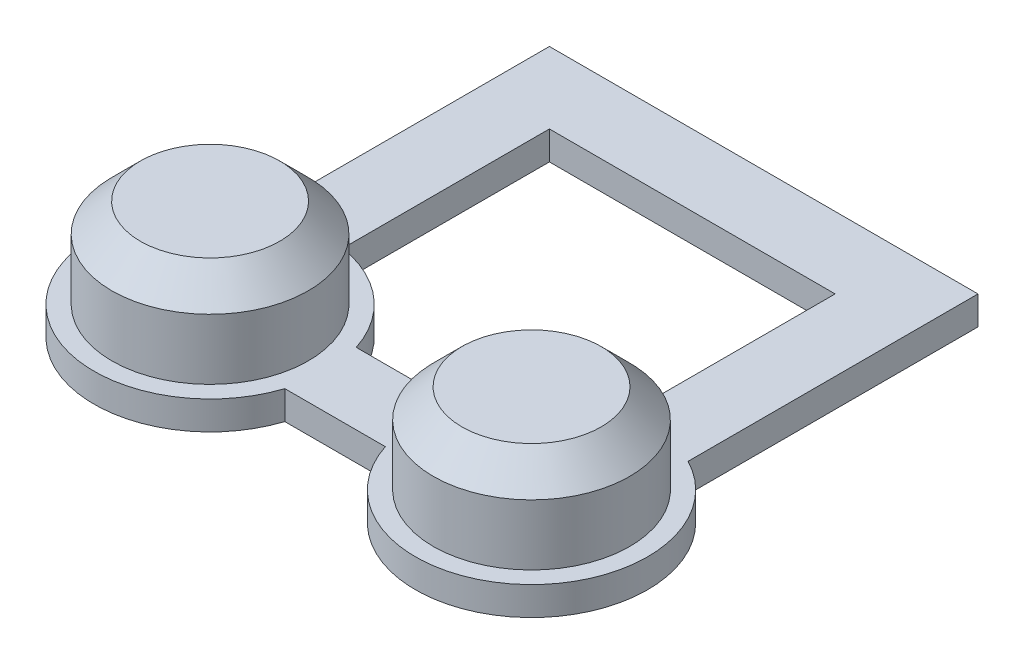
from build123d import *

# Parameters (mm, degrees)
SKETCH_1_R      = 3.25
EXTRUDE_1_DEPTH = 0.8
SKETCH_2_R      = 2.75
EXTRUDE_2_DEPTH = 2.5
CHAMFER_1_SIZE  = 0.8
SKETCH_3_R      = 1
EXTRUDE_3_DEPTH = 0.45
SKETCH_4_W      = 12
SKETCH_4_H      = 12
SKETCH_4_W_2    = 8
SKETCH_4_H_2    = 8
EXTRUDE_4_DEPTH = 0.8


with BuildPart() as part:
    # 草图1 → 凸台-拉伸1 (new body)
    with BuildSketch(Plane(origin=(0, 0, 0), x_dir=(1, 0, 0), z_dir=(0, 1, 0))):
        with Locations((-4.5, 0)):
            Circle(SKETCH_1_R)
        with BuildLine():
            Line((1.33772234, 0.75), (-1.33772234, 0.75))
            ThreePointArc((-1.33772234, 0.75), (-1.272005081, 0.377556356), (-1.25, 0))
            ThreePointArc((-1.25, 0), (-1.272005081, -0.377556356), (-1.33772234, -0.75))
            Line((-1.33772234, -0.75), (1.33772234, -0.75))
            ThreePointArc((1.33772234, -0.75), (1.25, 0), (1.33772234, 0.75))
        make_face()
        with Locations((4.5, 0)):
            Circle(SKETCH_1_R)
    extrude(amount=EXTRUDE_1_DEPTH)

    # 草图2 → 凸台-拉伸2 (add)
    with BuildSketch(Plane(origin=(0, 0.8, 0), x_dir=(1, 0, 0), z_dir=(0, 1, 0))):
        with Locations(Location((-4.5, 0, 0), (0, 0, 270))):
            Circle(SKETCH_2_R)
        with Locations(Location((4.5, 0, 0), (0, 0, 270))):
            Circle(SKETCH_2_R)
    extrude(amount=EXTRUDE_2_DEPTH)

    # 倒角1
    chamfer_1_edges = [part.edges().sort_by_distance(p)[0] for p in [
        (-4.5, 3.3, -2.75),
        (4.5, 3.3, -2.75),
    ]]
    chamfer(chamfer_1_edges, length=CHAMFER_1_SIZE)

    # 草图3 → 凸台-拉伸3 (add)
    with BuildSketch(Plane.XZ):
        with Locations(Location((-4.5, 0, 0), (0, 0, 270))):
            Circle(SKETCH_3_R)
        with Locations(Location((4.5, 0, 0), (0, 0, 90))):
            Circle(SKETCH_3_R)
    extrude(amount=EXTRUDE_3_DEPTH)

    # 草图4 → 凸台-拉伸4 (add)
    with BuildSketch(Plane.XZ):
        with Locations((0, -5)):
            Rectangle(SKETCH_4_W, SKETCH_4_H)
        with Locations((0, -5)):
            Rectangle(SKETCH_4_W_2, SKETCH_4_H_2, mode=Mode.SUBTRACT)
    extrude(amount=-EXTRUDE_4_DEPTH)


solid = part.part
